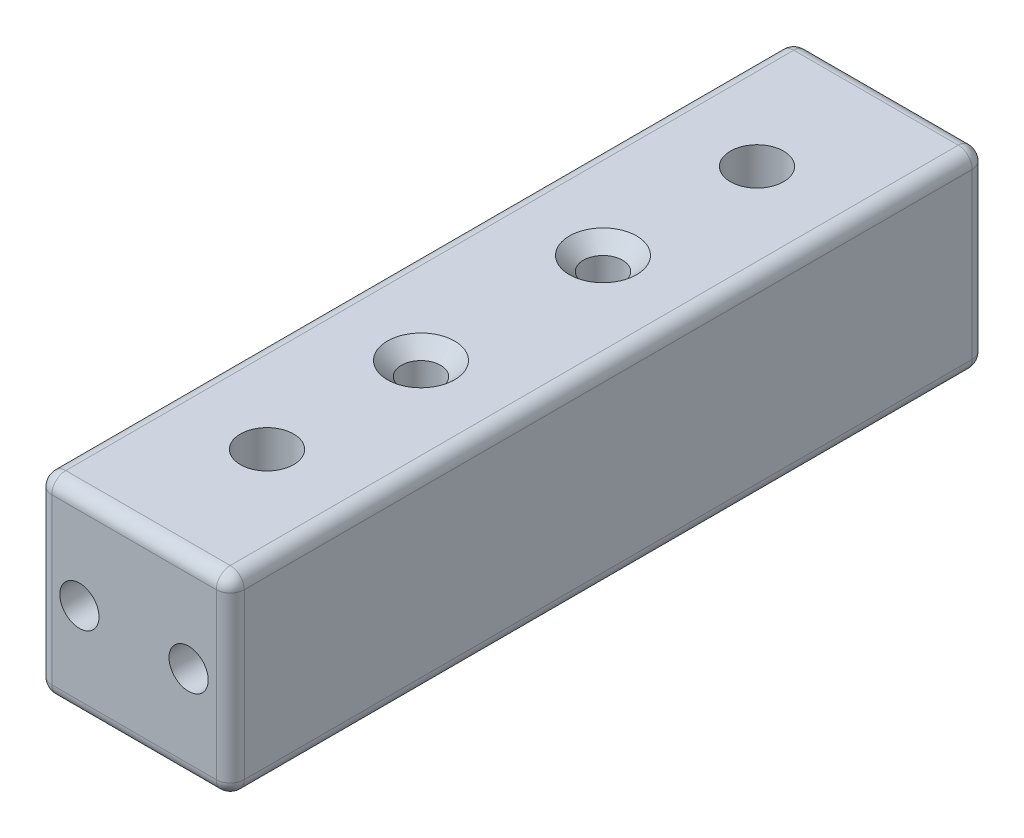
from build123d import *

# Parameters (mm, degrees)
SKETCH1_W           = 13.75
SKETCH1_H           = 13.75
BOSS_EXTRUDE1_DEPTH = 54
SKETCH3_R           = 1.9
SKETCH3_R_2         = 1.4
CUT_EXTRUDE2_DEPTH  = 57.145597557
SKETCH9_R           = 1.4
CUT_EXTRUDE7_DEPTH  = 55.868308248
FILLET2_R           = 1
CHAMFER1_SIZE       = 1


with BuildPart() as part:
    # Sketch1 → Boss-Extrude1 (new body)
    with BuildSketch(Plane.XY):
        Rectangle(SKETCH1_W, SKETCH1_H)
    extrude(amount=BOSS_EXTRUDE1_DEPTH)

    # Sketch3 → Cut-Extrude2 (cut, through all)
    with BuildSketch(Plane(origin=(0, 6.875, 0), x_dir=(1, 0, 0), z_dir=(0, 1, 0))):
        with Locations((0, -9.5)):
            Circle(SKETCH3_R)
        with Locations((0, -44.5)):
            Circle(SKETCH3_R)
        with Locations((0, -20.5)):
            Circle(SKETCH3_R_2)
        with Locations((0, -33.5)):
            Circle(SKETCH3_R_2)
    extrude(amount=-CUT_EXTRUDE2_DEPTH, mode=Mode.SUBTRACT)

    # Sketch9 → Cut-Extrude7 (cut, through all)
    with BuildSketch(Plane(origin=(0, 0, 0), x_dir=(-1, 0, 0), z_dir=(0, 0, -1))):
        with Locations((-3.9, 0)):
            Circle(SKETCH9_R)
    cut_extrude7 = extrude(amount=-CUT_EXTRUDE7_DEPTH, mode=Mode.SUBTRACT)

    # Mirror5: Cut-Extrude7 across plane
    add(cut_extrude7.mirror(Plane(origin=(0, 0, 0), x_dir=(0, 0, 1), z_dir=(1, 0, 0))), mode=Mode.SUBTRACT)

    # Fillet2
    fillet2_edges = [part.edges().sort_by_distance(p)[0] for p in [
        (0, 6.875, 0),
        (-6.875, 0, 0),
        (0, -6.875, 0),
        (6.875, 0, 0),
        (6.875, 0, 54),
        (-6.875, 0, 54),
        (0, 6.875, 54),
        (6.875, -6.875, 27),
        (-6.875, -6.875, 27),
        (6.875, 6.875, 27),
        (-6.875, 6.875, 27),
        (0, -6.875, 54),
    ]]
    fillet(fillet2_edges, radius=FILLET2_R)

    # Chamfer1
    chamfer1_edges = [part.edges().sort_by_distance(p)[0] for p in [
        (-1.4, -6.875, 20.5),
        (-1.4, -6.875, 33.5),
        (-1.4, 6.875, 33.5),
        (-1.4, 6.875, 20.5),
    ]]
    chamfer(chamfer1_edges, length=CHAMFER1_SIZE)


solid = part.part
